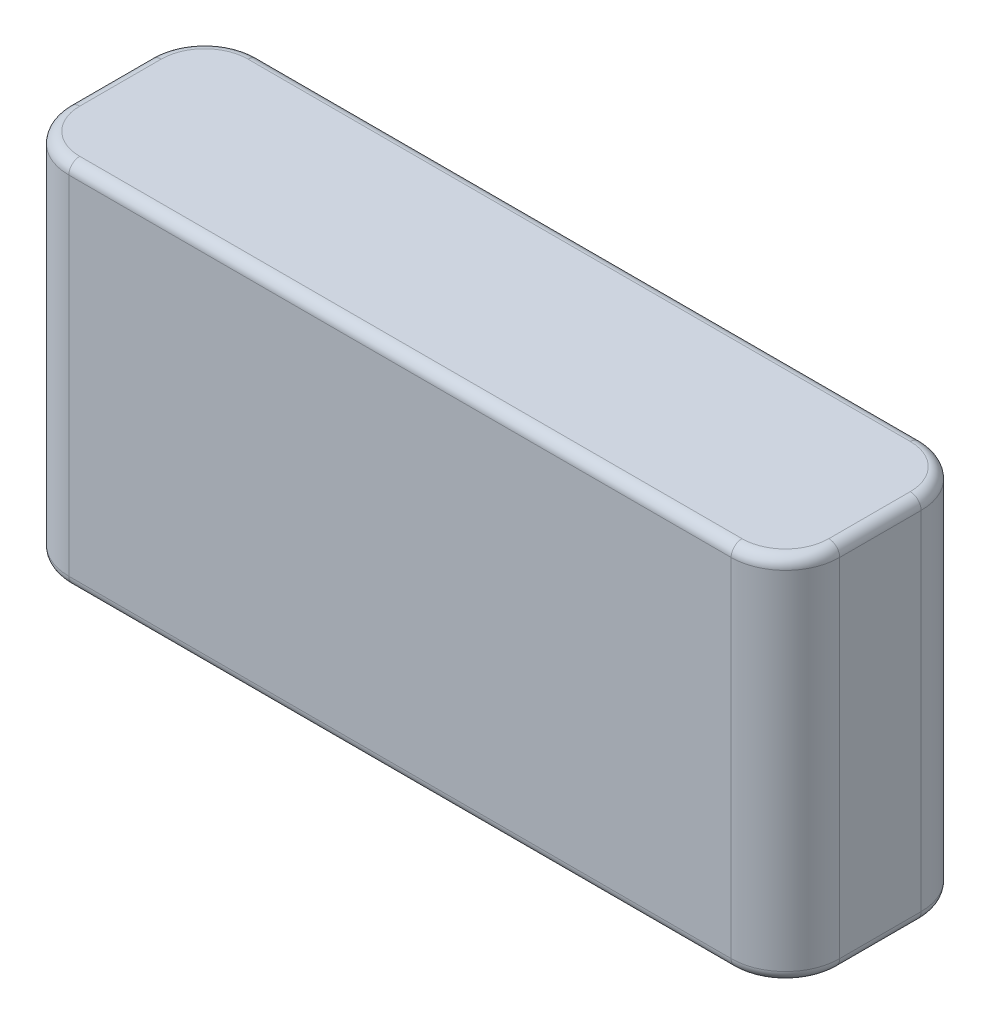
from build123d import *

# Parameters (mm, degrees)
SKETCH1_W           = 71
SKETCH1_H           = 34
BOSS_EXTRUDE1_DEPTH = 8.75
FILLET1_R           = 5
FILLET2_R           = 1


with BuildPart() as part:
    # Sketch1 → Boss-Extrude1 (new, symmetric)
    with BuildSketch(Plane.XY):
        Rectangle(SKETCH1_W, SKETCH1_H)
    extrude(amount=BOSS_EXTRUDE1_DEPTH, both=True)

    # Fillet1
    fillet1_edges = [part.edges().sort_by_distance(p)[0] for p in [
        (-35.5, 0, 8.75),
        (35.5, 0, 8.75),
        (-35.5, 0, -8.75),
        (35.5, 0, -8.75),
    ]]
    fillet(fillet1_edges, radius=FILLET1_R)

    # Fillet2
    fillet2_edges = [part.edges().sort_by_distance(p)[0] for p in [
        (35.5, 17, 0),
        (35.5, -17, 0),
        (0, 17, -8.75),
        (-35.5, 17, 0),
        (0, 17, 8.75),
        (-34.035533906, 17, -7.285533906),
        (-34.035533906, 17, 7.285533906),
        (34.035533906, 17, 7.285533906),
        (34.035533906, 17, -7.285533906),
        (0, -17, -8.75),
        (0, -17, 8.75),
        (-35.5, -17, 0),
        (-34.035533906, -17, -7.285533906),
        (-34.035533906, -17, 7.285533906),
        (34.035533906, -17, 7.285533906),
        (34.035533906, -17, -7.285533906),
    ]]
    fillet(fillet2_edges, radius=FILLET2_R)


solid = part.part
